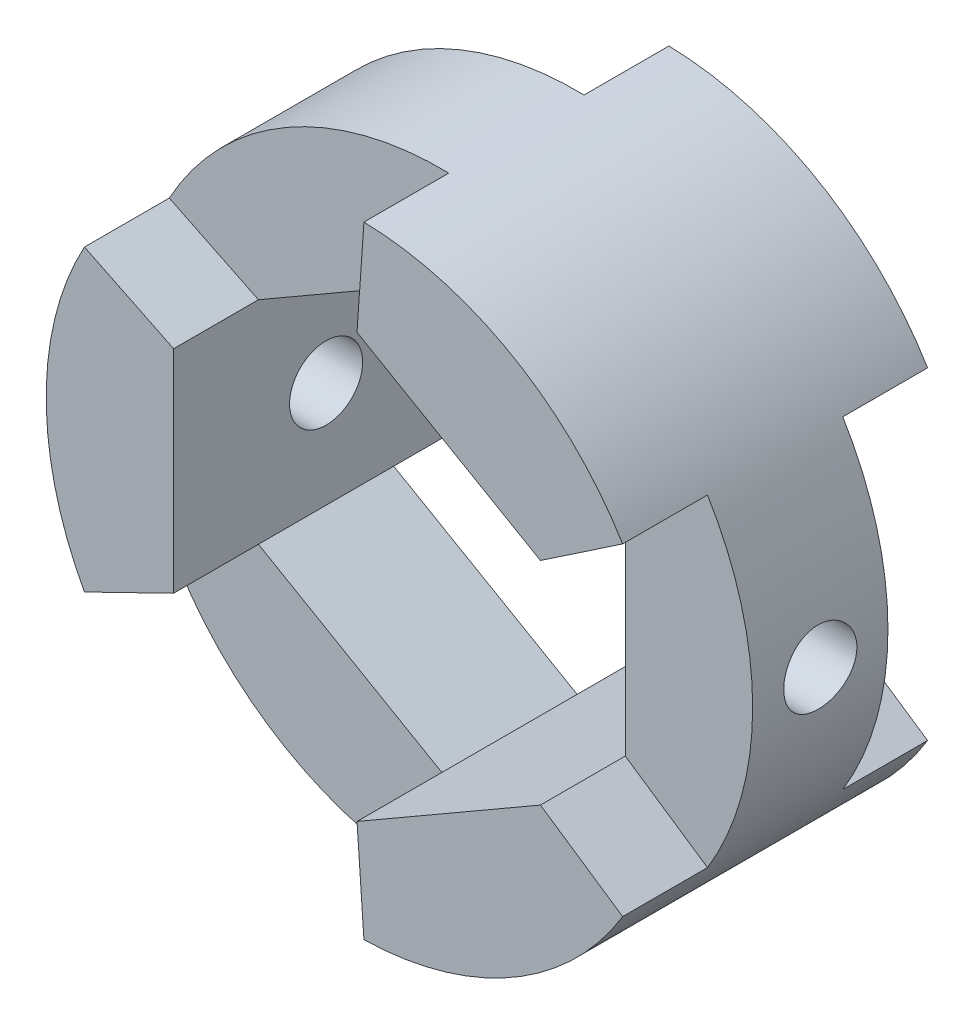
from build123d import *
from build123d.topology import SkipClean

# Parameters (mm, degrees)
SKETCH1_W                = 13.493749999999999
SKETCH1_H                = 9.55675
CUT_EXTRUDE1_DEPTH       = 3.683
CUT_EXTRUDE2_DEPTH       = 3.683
CUT_EXTRUDE3_DEPTH       = 22.342306545626695
BOSS_EXTRUDE1_START      = 3.6830000000000003
BOSS_EXTRUDE1_DEPTH      = 3.6830000000000003
BOSS_EXTRUDE2_DEPTH      = 3.683
BOSS_EXTRUDE3_DEPTH      = 3.683
BOSS_EXTRUDE4_DEPTH      = 3.6830000000000007
M2_CLEARANCE_HOLE1_D     = 2.2606
M2_CLEARANCE_HOLE1_DEPTH = 5.530875
HOLE1_D                  = 3.175
HOLE1_DEPTH              = 26.987525
HOLE1_CBORE_D            = 5.55752
HOLE1_CBORE_DEPTH        = 3.175


with BuildPart() as part:
    # Sketch1 → Revolve1 (revolve)
    with BuildSketch(Plane.XZ, mode=Mode.PRIVATE) as revolve1_sk:
        with Locations((6.746874999999999, 1.8414999999999997)):
            Rectangle(SKETCH1_W, SKETCH1_H)
    revolve(revolve1_sk.sketch.rotate(Axis((0, 0, 6.6198749999999995), (0, 0, -1)), 180), axis=Axis((0, 0, 6.6198749999999995), (0, 0, -1)))

    # Sketch2 → Cut-Extrude1 (cut)
    with BuildSketch(Plane.XY.offset(6.6198749999999995)):
        with BuildLine():
            Line((11.532844262672493, 7.005340268355434), (1.1470002096581853, 6.94e-15))
            Line((1.1470002096581853, 6.94e-15), (11.532844262672493, -7.005340268355431))
            ThreePointArc((11.532844262672493, -7.005340268355431), (13.493749999999999, 1.5e-15), (11.532844262672493, 7.005340268355434))
        make_face()
    extrude(amount=-CUT_EXTRUDE1_DEPTH, mode=Mode.SUBTRACT)

    # Sketch3 → Cut-Extrude2 (cut)
    with BuildSketch(Plane.XY.offset(6.6198749999999995)):
        with BuildLine():
            Line((-0.6429605972199295, -9.714e-14), (0.3003805032135874, 13.490406243541708))
            ThreePointArc((0.3003805032135874, 13.490406243541708), (-13.493749999999999, 1.65e-15), (0.3003805032135965, -13.49040624354171))
            Line((0.3003805032135965, -13.49040624354171), (-0.6429605972199295, -9.714e-14))
        make_face()
    extrude(amount=-CUT_EXTRUDE2_DEPTH, mode=Mode.SUBTRACT)

    # Sketch4 → Cut-Extrude3 (cut, through all)
    with BuildSketch(Plane(origin=(0, 0, -2.936875), x_dir=(-1, 0, 0), z_dir=(0, 0, -1))):
        Polygon((-7.9628999999999985, -4.597382458530073), (0, -9.19476491706014), (7.962900000000002, -4.597382458530068), (7.962900000000002, 4.597382458530077), (-5.2e-15, 9.194764917060152), (-7.962899999999997, 4.5973824585300775), align=None)
    extrude(amount=-CUT_EXTRUDE3_DEPTH, mode=Mode.SUBTRACT)

    # Sketch5 → Boss-Extrude1 (add)
    with BuildSketch(Plane.XY.offset(2.936875).offset(BOSS_EXTRUDE1_START)):
        with BuildLine():
            Line((-11.833224765886177, 6.485065975186222), (-7.962900000000002, 4.597382458530077))
            Line((-7.962900000000002, 4.597382458530077), (-7.962900000000002, -4.597382458530068))
            Line((-7.962900000000002, -4.597382458530068), (-11.833224765886175, -6.485065975186225))
            ThreePointArc((-11.833224765886175, -6.485065975186225), (-13.49375, -1.65e-15), (-11.833224765886177, 6.485065975186222))
        make_face()
    extrude(amount=-BOSS_EXTRUDE1_DEPTH)

    # Sketch6 → Boss-Extrude2 (add)
    with SkipClean():  # the faces are left unmerged after this step: merging them gives an invalid solid
        with BuildSketch(Plane(origin=(0, 0, -2.936875), x_dir=(-1, 0, 0), z_dir=(0, 0, -1))):
            with BuildLine():
                Line((0, 9.194764917060148), (-7.962899999999997, 4.5973824585300775))
                Line((-7.962899999999997, 4.5973824585300775), (-11.53284426267249, 7.005340268355432))
                ThreePointArc((-11.53284426267249, 7.005340268355432), (-6.746874999999971, 11.685930292316284), (-0.30038050321358717, 13.490406243541708))
                Line((-0.30038050321358717, 13.490406243541708), (0, 9.194764917060148))
            make_face()
        extrude(amount=BOSS_EXTRUDE2_DEPTH)

    # Sketch7 → Boss-Extrude3 (add)
    with SkipClean():  # the faces are left unmerged after this step: merging them gives an invalid solid
        with BuildSketch(Plane(origin=(0, 0, -2.936875), x_dir=(-1, 0, 0), z_dir=(0, 0, -1))):
            with BuildLine():
                Line((11.833224765886175, -6.485065975186224), (7.962900000000002, -4.597382458530068))
                Line((7.962900000000002, -4.597382458530068), (7.962900000000002, 4.597382458530077))
                Line((7.962900000000002, 4.597382458530077), (11.833224765886177, 6.485065975186222))
                ThreePointArc((11.833224765886177, 6.485065975186222), (13.49375, 0), (11.833224765886175, -6.485065975186224))
            make_face()
        extrude(amount=BOSS_EXTRUDE3_DEPTH)

    # Sketch8 → Boss-Extrude4 (add)
    with SkipClean():  # the faces are left unmerged after this step: merging them gives an invalid solid
        with BuildSketch(Plane(origin=(0, 0, -2.936875), x_dir=(-1, 0, 0), z_dir=(0, 0, -1))):
            with BuildLine():
                Line((-11.532844262672493, -7.005340268355434), (-7.9628999999999985, -4.597382458530073))
                Line((-7.9628999999999985, -4.597382458530073), (0, -9.19476491706014))
                Line((0, -9.19476491706014), (-0.30038050321359694, -13.49040624354171))
                ThreePointArc((-0.30038050321359694, -13.49040624354171), (-6.746874999999972, -11.685930292316286), (-11.532844262672493, -7.005340268355434))
            make_face()
        extrude(amount=BOSS_EXTRUDE4_DEPTH)

    # M2 Clearance Hole1
    with Locations(Plane.ZY.offset(-7.9628999999999985)):
        with Locations((0, 0)):
            Hole(M2_CLEARANCE_HOLE1_D / 2, depth=M2_CLEARANCE_HOLE1_DEPTH)

    # Hole1
    with Locations(Plane(origin=(-13.49375, 0, 0), x_dir=(0, 0, -1), z_dir=(-1, 0, 0))):
        with Locations((0, 0)):
            CounterBoreHole(HOLE1_D / 2, HOLE1_CBORE_D / 2, HOLE1_CBORE_DEPTH, depth=HOLE1_DEPTH)


solid = part.part
